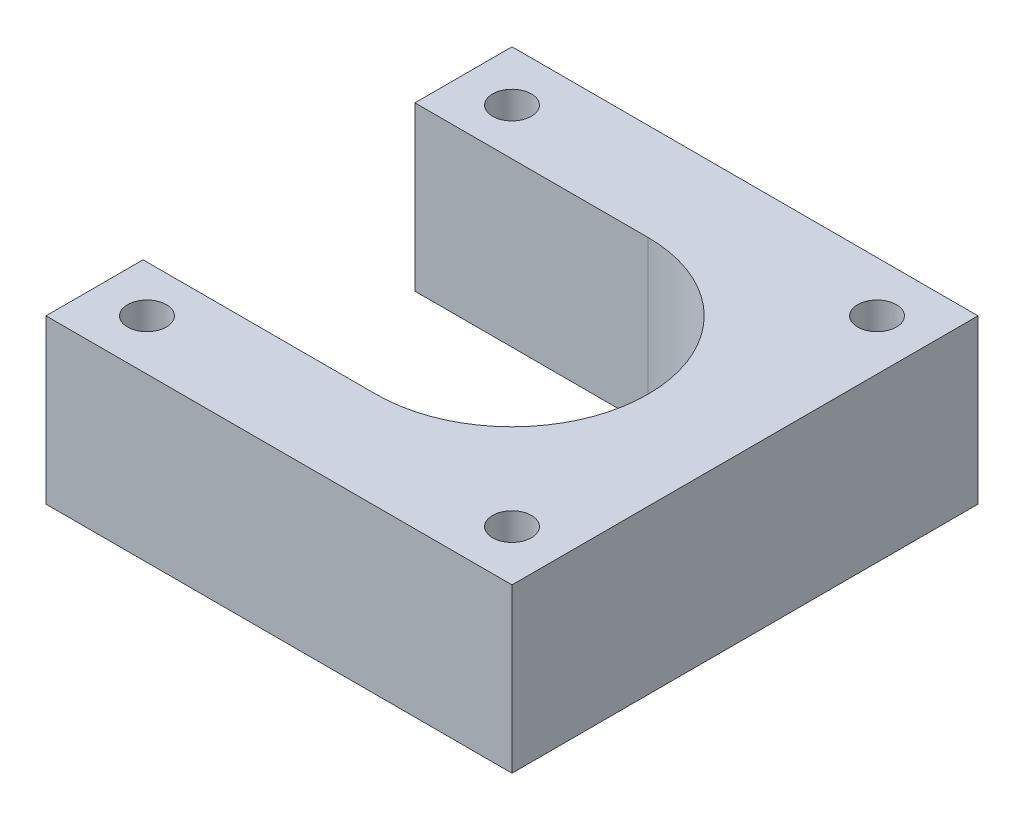
from build123d import *

# Parameters (mm, degrees)
SKETCH1_R           = 2.5
BOSS_EXTRUDE1_DEPTH = 21


with BuildPart() as part:
    # Sketch1 → Boss-Extrude1 (new body)
    with BuildSketch(Plane(origin=(0, 0, 0), x_dir=(1, 0, 0), z_dir=(0, 1, 0))):
        with BuildLine():
            Line((0, 17.5), (-30, 17.5))
            Line((-30, 17.5), (-30, 30))
            Line((-30, 30), (30, 30))
            Line((30, 30), (30, -30))
            Line((30, -30), (-30, -30))
            Line((-30, -30), (-30, -17.5))
            Line((-30, -17.5), (0, -17.5))
            ThreePointArc((0, -17.5), (17.5, 0), (0, 17.5))
        make_face()
        with Locations(Location((-23.5, 23.5, 0), (0, 0, 90))):
            Circle(SKETCH1_R, mode=Mode.SUBTRACT)
        with Locations(Location((23.5, 23.5, 0), (0, 0, 90))):
            Circle(SKETCH1_R, mode=Mode.SUBTRACT)
        with Locations(Location((-23.5, -23.5, 0), (0, 0, 90))):
            Circle(SKETCH1_R, mode=Mode.SUBTRACT)
        with Locations(Location((23.5, -23.5, 0), (0, 0, 90))):
            Circle(SKETCH1_R, mode=Mode.SUBTRACT)
    extrude(amount=BOSS_EXTRUDE1_DEPTH)


solid = part.part
